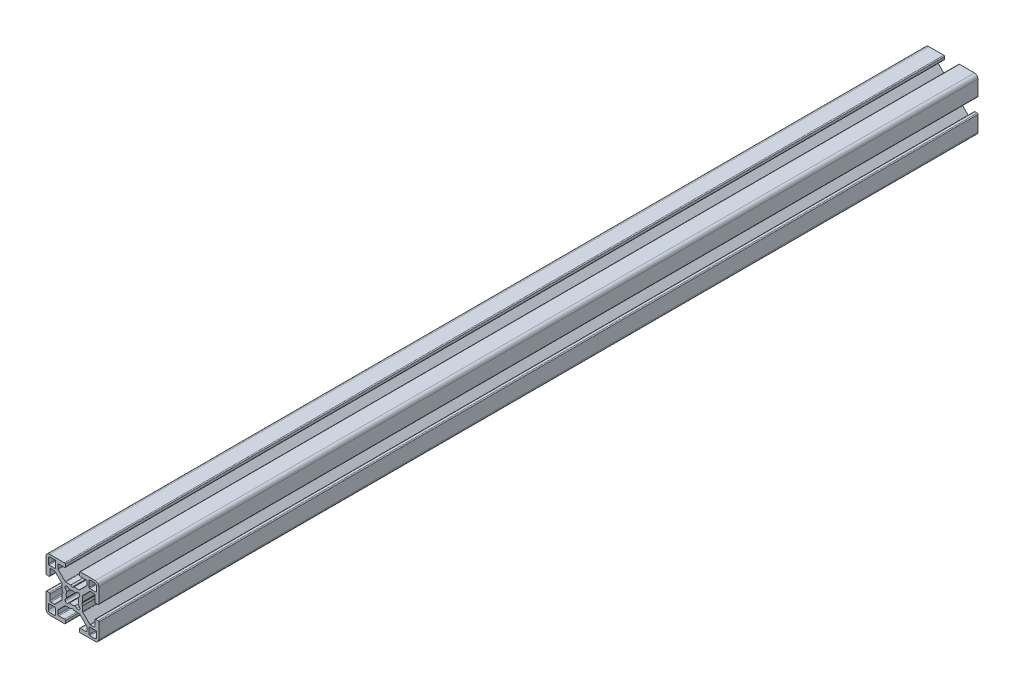
from build123d import *

# Parameters (mm, degrees)
EXTRUDE1_DEPTH = 500


with BuildPart() as part:
    # Sketch1 → Extrude1 (new body)
    with BuildSketch(Plane.XY):
        with BuildLine():
            Line((12.74247465, -4.5), (12.74247465, -7.732519321))
            ThreePointArc((12.74247465, -7.732519321), (12.602449697, -8.097296796), (12.242781236, -8.249967))
            Line((12.242781236, -8.249967), (10.260188032, -8.249967))
            ThreePointArc((10.260188032, -8.249967), (10.068847082, -8.211906919), (9.906636056, -8.103520976))
            Line((9.906636056, -8.103520976), (5.981117769, -4.178002689))
            ThreePointArc((5.981117769, -4.178002689), (5.872731827, -4.015791664), (5.834671745, -3.824450713))
            Line((5.834671745, -3.824450713), (5.834671745, -1.01249595))
            Line((5.834671745, -1.01249595), (5.324673785, -0.06249975))
            Line((5.324673785, -0.06249975), (5.834671745, 0.88749645))
            Line((5.834671745, 0.88749645), (5.834671745, 3.824450713))
            ThreePointArc((5.834671745, 3.824450713), (5.872731827, 4.015791664), (5.981117769, 4.178002689))
            Line((5.981117769, 4.178002689), (9.906636056, 8.103520976))
            ThreePointArc((9.906636056, 8.103520976), (10.068847082, 8.211906919), (10.260188032, 8.249967))
            Line((10.260188032, 8.249967), (12.242781236, 8.249967))
            ThreePointArc((12.242781236, 8.249967), (12.602449697, 8.097296796), (12.74247465, 7.732519321))
            Line((12.74247465, 7.732519321), (12.74247465, 4.5))
            ThreePointArc((12.74247465, 4.5), (12.88892126, 4.146446609), (13.24247465, 4))
            Line((13.24247465, 4), (14.49994, 4))
            ThreePointArc((14.49994, 4), (14.853493391, 4.146446609), (14.99994, 4.5))
            Line((14.99994, 4.5), (14.99994, 12.999948))
            ThreePointArc((14.99994, 12.999948), (14.414155906, 14.414155906), (12.999948, 14.99994))
            Line((12.999948, 14.99994), (4.5, 14.99994))
            ThreePointArc((4.5, 14.99994), (4.146446609, 14.853493391), (4, 14.49994))
            Line((4, 14.49994), (4, 13.24247465))
            ThreePointArc((4, 13.24247465), (4.146446609, 12.88892126), (4.5, 12.74247465))
            Line((4.5, 12.74247465), (7.732519321, 12.74247465))
            ThreePointArc((7.732519321, 12.74247465), (8.097296796, 12.602449697), (8.249967, 12.242781236))
            Line((8.249967, 12.242781236), (8.249967, 10.260188032))
            ThreePointArc((8.249967, 10.260188032), (8.211906919, 10.068847082), (8.103520976, 9.906636056))
            Line((8.103520976, 9.906636056), (4.178002689, 5.981117769))
            ThreePointArc((4.178002689, 5.981117769), (4.015791664, 5.872731827), (3.824450713, 5.834671745))
            Line((3.824450713, 5.834671745), (0.9499962, 5.834671745))
            Line((0.9499962, 5.834671745), (0, 5.324673785))
            Line((0, 5.324673785), (-0.9499962, 5.834671745))
            Line((-0.9499962, 5.834671745), (-3.824450713, 5.834671745))
            ThreePointArc((-3.824450713, 5.834671745), (-4.015791664, 5.872731827), (-4.178002689, 5.981117769))
            Line((-4.178002689, 5.981117769), (-8.103520976, 9.906636056))
            ThreePointArc((-8.103520976, 9.906636056), (-8.211906919, 10.068847082), (-8.249967, 10.260188032))
            Line((-8.249967, 10.260188032), (-8.249967, 12.242781236))
            ThreePointArc((-8.249967, 12.242781236), (-8.097296796, 12.602449697), (-7.732519321, 12.74247465))
            Line((-7.732519321, 12.74247465), (-4.5, 12.74247465))
            ThreePointArc((-4.5, 12.74247465), (-4.146446609, 12.88892126), (-4, 13.24247465))
            Line((-4, 13.24247465), (-4, 14.49994))
            ThreePointArc((-4, 14.49994), (-4.146446609, 14.853493391), (-4.5, 14.99994))
            Line((-4.5, 14.99994), (-12.999948, 14.99994))
            ThreePointArc((-12.999948, 14.99994), (-14.414155906, 14.414155906), (-14.99994, 12.999948))
            Line((-14.99994, 12.999948), (-14.99994, 4.5))
            ThreePointArc((-14.99994, 4.5), (-14.853493391, 4.146446609), (-14.49994, 4))
            Line((-14.49994, 4), (-13.24247465, 4))
            ThreePointArc((-13.24247465, 4), (-12.88892126, 4.146446609), (-12.74247465, 4.5))
            Line((-12.74247465, 4.5), (-12.74247465, 7.732519321))
            ThreePointArc((-12.74247465, 7.732519321), (-12.602449697, 8.097296796), (-12.242781236, 8.249967))
            Line((-12.242781236, 8.249967), (-10.260188032, 8.249967))
            ThreePointArc((-10.260188032, 8.249967), (-10.068847082, 8.211906919), (-9.906636056, 8.103520976))
            Line((-9.906636056, 8.103520976), (-5.981117769, 4.178002689))
            ThreePointArc((-5.981117769, 4.178002689), (-5.872731827, 4.015791664), (-5.834671745, 3.824450713))
            Line((-5.834671745, 3.824450713), (-5.834671745, 0.88749645))
            Line((-5.834671745, 0.88749645), (-5.324673785, -0.06249975))
            Line((-5.324673785, -0.06249975), (-5.834671745, -1.01249595))
            Line((-5.834671745, -1.01249595), (-5.834671745, -3.824450713))
            ThreePointArc((-5.834671745, -3.824450713), (-5.872731827, -4.015791664), (-5.981117769, -4.178002689))
            Line((-5.981117769, -4.178002689), (-9.906636056, -8.103520976))
            ThreePointArc((-9.906636056, -8.103520976), (-10.068847082, -8.211906919), (-10.260188032, -8.249967))
            Line((-10.260188032, -8.249967), (-12.242781236, -8.249967))
            ThreePointArc((-12.242781236, -8.249967), (-12.602449697, -8.097296796), (-12.74247465, -7.732519321))
            Line((-12.74247465, -7.732519321), (-12.74247465, -4.5))
            ThreePointArc((-12.74247465, -4.5), (-12.88892126, -4.146446609), (-13.24247465, -4))
            Line((-13.24247465, -4), (-14.49994, -4))
            ThreePointArc((-14.49994, -4), (-14.853493391, -4.146446609), (-14.99994, -4.5))
            Line((-14.99994, -4.5), (-14.99994, -12.999948))
            ThreePointArc((-14.99994, -12.999948), (-14.414155906, -14.414155906), (-12.999948, -14.99994))
            Line((-12.999948, -14.99994), (-4.5, -14.99994))
            ThreePointArc((-4.5, -14.99994), (-4.146446609, -14.853493391), (-4, -14.49994))
            Line((-4, -14.49994), (-4, -13.24247465))
            ThreePointArc((-4, -13.24247465), (-4.146446609, -12.88892126), (-4.5, -12.74247465))
            Line((-4.5, -12.74247465), (-7.732519321, -12.74247465))
            ThreePointArc((-7.732519321, -12.74247465), (-8.097296796, -12.602449697), (-8.249967, -12.242781236))
            Line((-8.249967, -12.242781236), (-8.249967, -10.260188032))
            ThreePointArc((-8.249967, -10.260188032), (-8.211906919, -10.068847082), (-8.103520976, -9.906636056))
            Line((-8.103520976, -9.906636056), (-4.178002689, -5.981117769))
            ThreePointArc((-4.178002689, -5.981117769), (-4.015791664, -5.872731827), (-3.824450713, -5.834671745))
            Line((-3.824450713, -5.834671745), (-0.9499962, -5.834671745))
            Line((-0.9499962, -5.834671745), (0, -5.324673785))
            Line((0, -5.324673785), (0.9499962, -5.834671745))
            Line((0.9499962, -5.834671745), (3.824450713, -5.834671745))
            ThreePointArc((3.824450713, -5.834671745), (4.015791664, -5.872731827), (4.178002689, -5.981117769))
            Line((4.178002689, -5.981117769), (8.103520976, -9.906636056))
            ThreePointArc((8.103520976, -9.906636056), (8.211906919, -10.068847082), (8.249967, -10.260188032))
            Line((8.249967, -10.260188032), (8.249967, -12.242781236))
            ThreePointArc((8.249967, -12.242781236), (8.097296796, -12.602449697), (7.732519321, -12.74247465))
            Line((7.732519321, -12.74247465), (4.5, -12.74247465))
            ThreePointArc((4.5, -12.74247465), (4.146446609, -12.88892126), (4, -13.24247465))
            Line((4, -13.24247465), (4, -14.49994))
            ThreePointArc((4, -14.49994), (4.146446609, -14.853493391), (4.5, -14.99994))
            Line((4.5, -14.99994), (12.999948, -14.99994))
            ThreePointArc((12.999948, -14.99994), (14.414155906, -14.414155906), (14.99994, -12.999948))
            Line((14.99994, -12.999948), (14.99994, -4.5))
            ThreePointArc((14.99994, -4.5), (14.853493391, -4.146446609), (14.49994, -4))
            Line((14.49994, -4), (13.24247465, -4))
            ThreePointArc((13.24247465, -4), (12.88892126, -4.146446609), (12.74247465, -4.5))
        make_face()
        with BuildLine():
            Line((9.499962, -13.318946724), (9.499962, -9.87996048))
            ThreePointArc((9.499962, -9.87996048), (9.611260978, -9.611260978), (9.87996048, -9.499962))
            Line((9.87996048, -9.499962), (13.318946724, -9.499962))
            ThreePointArc((13.318946724, -9.499962), (13.58835333, -9.61155387), (13.6999452, -9.880960476))
            Line((13.6999452, -9.880960476), (13.6999452, -12.6999492))
            ThreePointArc((13.6999452, -12.6999492), (13.407053153, -13.407053153), (12.6999492, -13.6999452))
            Line((12.6999492, -13.6999452), (9.880960476, -13.6999452))
            ThreePointArc((9.880960476, -13.6999452), (9.61155387, -13.58835333), (9.499962, -13.318946724))
        make_face(mode=Mode.SUBTRACT)
        with BuildLine():
            Line((-13.318946724, -9.499962), (-9.87996048, -9.499962))
            ThreePointArc((-9.87996048, -9.499962), (-9.611260978, -9.611260978), (-9.499962, -9.87996048))
            Line((-9.499962, -9.87996048), (-9.499962, -13.318946724))
            ThreePointArc((-9.499962, -13.318946724), (-9.61155387, -13.58835333), (-9.880960476, -13.6999452))
            Line((-9.880960476, -13.6999452), (-12.6999492, -13.6999452))
            ThreePointArc((-12.6999492, -13.6999452), (-13.407053153, -13.407053153), (-13.6999452, -12.6999492))
            Line((-13.6999452, -12.6999492), (-13.6999452, -9.880960476))
            ThreePointArc((-13.6999452, -9.880960476), (-13.58835333, -9.61155387), (-13.318946724, -9.499962))
        make_face(mode=Mode.SUBTRACT)
        with BuildLine():
            Line((-1.494225248, -3.198138712), (-2.473341823, -3.979927146))
            ThreePointArc((-2.473341823, -3.979927146), (-3.900227701, -3.900227701), (-3.979927146, -2.473341823))
            Line((-3.979927146, -2.473341823), (-3.198138712, -1.494225248))
            ThreePointArc((-3.198138712, -1.494225248), (-3.52998588, 0), (-3.198138712, 1.494225248))
            Line((-3.198138712, 1.494225248), (-3.979927146, 2.473341823))
            ThreePointArc((-3.979927146, 2.473341823), (-3.900227701, 3.900227701), (-2.473341823, 3.979927146))
            Line((-2.473341823, 3.979927146), (-1.494225248, 3.198138712))
            ThreePointArc((-1.494225248, 3.198138712), (0, 3.52998588), (1.494225248, 3.198138712))
            Line((1.494225248, 3.198138712), (2.473341823, 3.979927146))
            ThreePointArc((2.473341823, 3.979927146), (3.900227701, 3.900227701), (3.979927146, 2.473341823))
            Line((3.979927146, 2.473341823), (3.198138712, 1.494225248))
            ThreePointArc((3.198138712, 1.494225248), (3.52998588, 0), (3.198138712, -1.494225248))
            Line((3.198138712, -1.494225248), (3.979927146, -2.473341823))
            ThreePointArc((3.979927146, -2.473341823), (3.900227701, -3.900227701), (2.473341823, -3.979927146))
            Line((2.473341823, -3.979927146), (1.494225248, -3.198138712))
            ThreePointArc((1.494225248, -3.198138712), (0, -3.52998588), (-1.494225248, -3.198138712))
        make_face(mode=Mode.SUBTRACT)
        with BuildLine():
            Line((-9.499962, 13.318946724), (-9.499962, 9.87996048))
            ThreePointArc((-9.499962, 9.87996048), (-9.611260978, 9.611260978), (-9.87996048, 9.499962))
            Line((-9.87996048, 9.499962), (-13.318946724, 9.499962))
            ThreePointArc((-13.318946724, 9.499962), (-13.58835333, 9.61155387), (-13.6999452, 9.880960476))
            Line((-13.6999452, 9.880960476), (-13.6999452, 12.6999492))
            ThreePointArc((-13.6999452, 12.6999492), (-13.407053153, 13.407053153), (-12.6999492, 13.6999452))
            Line((-12.6999492, 13.6999452), (-9.880960476, 13.6999452))
            ThreePointArc((-9.880960476, 13.6999452), (-9.61155387, 13.58835333), (-9.499962, 13.318946724))
        make_face(mode=Mode.SUBTRACT)
        with BuildLine():
            Line((9.880960476, 13.6999452), (12.6999492, 13.6999452))
            ThreePointArc((12.6999492, 13.6999452), (13.407053153, 13.407053153), (13.6999452, 12.6999492))
            Line((13.6999452, 12.6999492), (13.6999452, 9.880960476))
            ThreePointArc((13.6999452, 9.880960476), (13.58835333, 9.61155387), (13.318946724, 9.499962))
            Line((13.318946724, 9.499962), (9.87996048, 9.499962))
            ThreePointArc((9.87996048, 9.499962), (9.611260978, 9.611260978), (9.499962, 9.87996048))
            Line((9.499962, 9.87996048), (9.499962, 13.318946724))
            ThreePointArc((9.499962, 13.318946724), (9.61155387, 13.58835333), (9.880960476, 13.6999452))
        make_face(mode=Mode.SUBTRACT)
    extrude(amount=-EXTRUDE1_DEPTH)


solid = part.part
